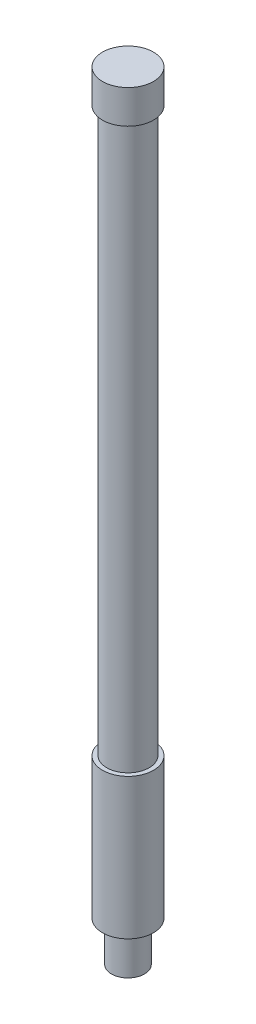
from build123d import *


with BuildPart() as part:
    # Sketch1 → Revolve1 (revolve)
    with BuildSketch(Plane.XY, mode=Mode.PRIVATE) as revolve1_sk:
        Polygon((0, -19.05), (7.8105, -19.05), (7.8105, 0), (12.065, 0), (12.065, 66.675), (10.033, 66.675), (10.033, 333.375), (12.065, 333.375), (12.065, 349.25), (0, 349.25), align=None)
    revolve(revolve1_sk.sketch.rotate(Axis((0, 349.25, 0), (0, -1, 0)), 180), axis=Axis((0, 349.25, 0), (0, -1, 0)))


solid = part.part
